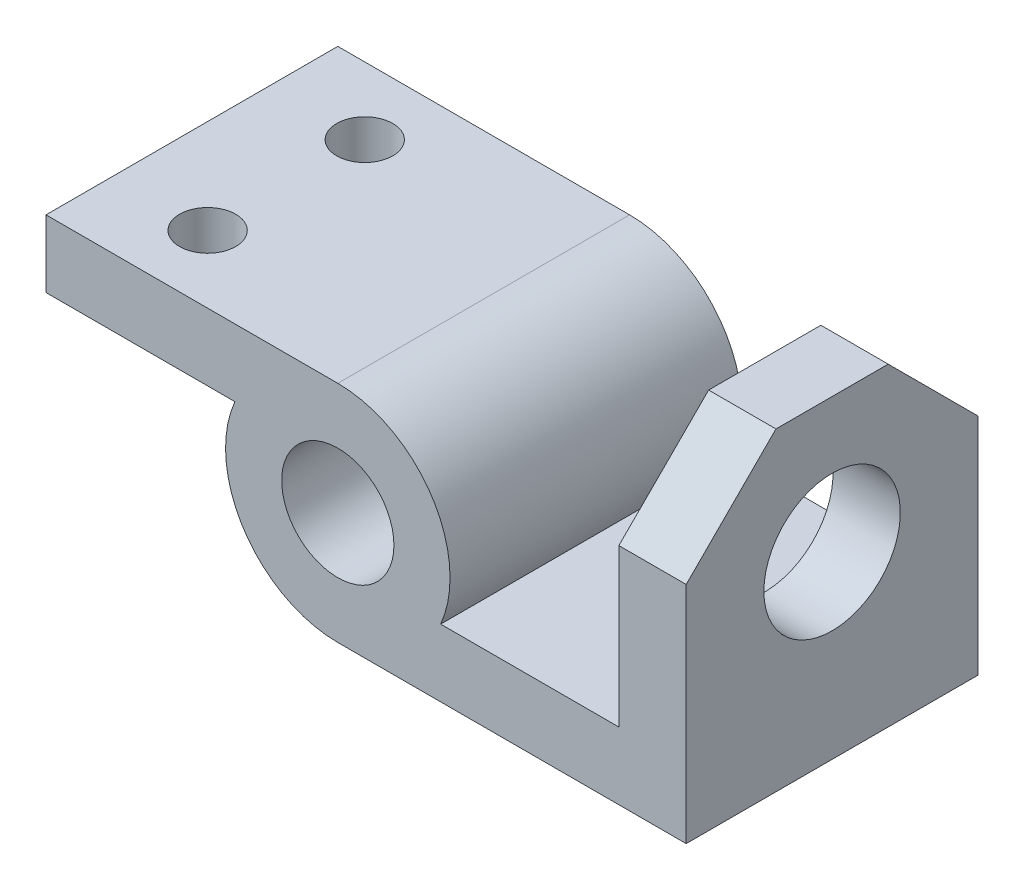
from build123d import *

# Parameters (mm, degrees)
SKETCH1_R           = 31.75
SKETCH1_R_2         = 15.875
BOSS_EXTRUDE1_DEPTH = 82.55
SKETCH2_R           = 19.304
BOSS_EXTRUDE2_DEPTH = 19.05
SKETCH3_R           = 7.9375
CUT_EXTRUDE1_DEPTH  = 19.05


with BuildPart() as part:
    # Sketch1 → Boss-Extrude1 (new body)
    # profile 1 of 3: a face of its own
    with BuildSketch(Plane.XY):
        with BuildLine():
            ThreePointArc((-29.099355663, 12.7), (-17.390191201, 26.563955842), (0, 31.75))
            Line((0, 31.75), (-82.55, 31.75))
            Line((-82.55, 31.75), (-82.55, 12.7))
            Line((-82.55, 12.7), (-29.099355663, 12.7))
        make_face()
    # profile 2 of 3: a face of its own
    with BuildSketch(Plane.XY):
        Circle(SKETCH1_R)
        Circle(SKETCH1_R_2, mode=Mode.SUBTRACT)
    # profile 3 of 3: a face of its own
    with BuildSketch(Plane.XY):
        with BuildLine():
            Line((79.502, -12.7), (29.099355663, -12.7))
            ThreePointArc((29.099355663, -12.7), (17.390191201, -26.563955842), (0, -31.75))
            Line((0, -31.75), (79.502, -31.75))
            Line((79.502, -31.75), (79.502, -12.7))
        make_face()
    extrude(amount=BOSS_EXTRUDE1_DEPTH)

    # Sketch2 → Boss-Extrude2 (add)
    with BuildSketch(Plane(origin=(79.502, 0, 0), x_dir=(0, 0, -1), z_dir=(1, 0, 0))):
        Polygon((-82.55, -31.75), (0, -31.75), (0, 31.75), (-25.4, 57.15), (-57.15, 57.15), (-82.55, 31.75), align=None)
        with Locations(Location((-41.275, 19.05, 0), (0, 0, 180))):
            Circle(SKETCH2_R, mode=Mode.SUBTRACT)
    extrude(amount=BOSS_EXTRUDE2_DEPTH)

    # Sketch3 → Cut-Extrude1 (cut)
    with BuildSketch(Plane(origin=(0, 31.75, 0), x_dir=(1, 0, 0), z_dir=(0, 1, 0))):
        with Locations(Location((-55.88, -19.05, 0), (0, 0, 180))):
            Circle(SKETCH3_R)
        with Locations(Location((-55.88, -63.5, 0), (0, 0, 180))):
            Circle(SKETCH3_R)
    extrude(amount=-CUT_EXTRUDE1_DEPTH, mode=Mode.SUBTRACT)


solid = part.part
